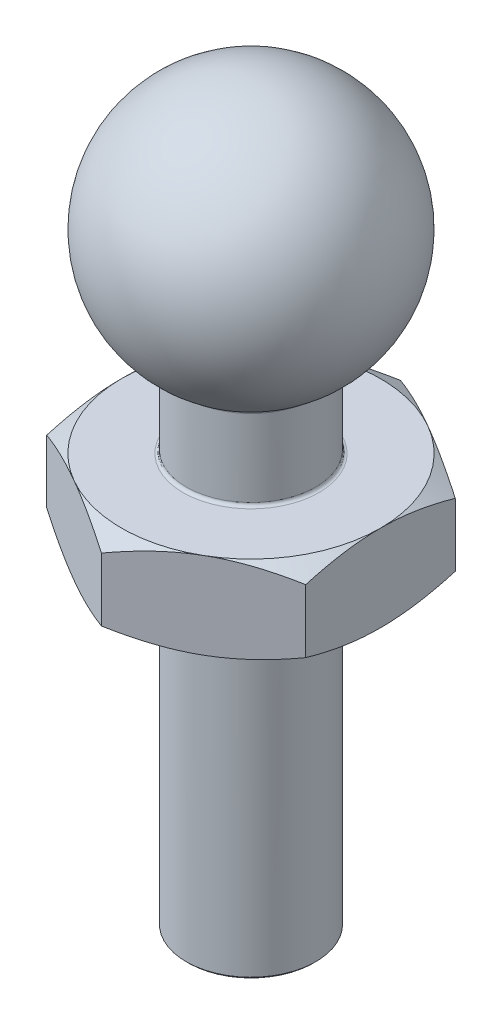
from build123d import *

# Parameters (mm, degrees)
CHAMFER1_SIZE       = 0.05
BOSS_EXTRUDE1_START = 2
SKETCH6_R           = 1.5
BOSS_EXTRUDE1_DEPTH = 2
SKETCH7_OUTSIDE_W   = 18.79
SKETCH7_OUTSIDE_H   = 19.718
SKETCH7_OUTSIDE_R   = 3
CUT_EXTRUDE1_DEPTH  = 2
CUT_EXTRUDE1_DRAFT  = -60
SKETCH8_OUTSIDE_W   = 18.79
SKETCH8_OUTSIDE_H   = 19.718
SKETCH8_OUTSIDE_R   = 3
CUT_EXTRUDE3_DEPTH  = 2
CUT_EXTRUDE3_DRAFT  = -60
FILLET1_R           = 0.075


with BuildPart() as part:
    # Sketch1 → Revolve1 (revolve)
    with BuildSketch(Plane.XY):
        with BuildLine():
            Line((0, 0), (1.5, 0))
            Line((1.5, 0), (1.5, 11.401923789))
            ThreePointArc((1.5, 11.401923789), (2.897777479, 14.776457135), (0, 17))
            Line((0, 17), (0, 11))
            Line((0, 11), (0, 0))
        make_face()
    revolve(axis=Axis((0, 11, 0), (0, -1, 0)))

    # Chamfer1
    chamfer1_edges = [part.edges().sort_by_distance(p)[0] for p in [
        (-1.5, 0, 0),
    ]]
    chamfer(chamfer1_edges, length=CHAMFER1_SIZE)

    # Sketch6 → Boss-Extrude1 (add)
    with BuildSketch(Plane(origin=(0, 7.5, 0), x_dir=(1, 0, 0), z_dir=(0, 1, 0)).offset(BOSS_EXTRUDE1_START)):
        Polygon((3, 1.732050808), (0, 3.464101615), (-3, 1.732050808), (-3, -1.732050808), (0, -3.464101615), (3, -1.732050808), align=None)
        with Locations(Location((0, 0, 0), (0, 0, 180))):
            Circle(SKETCH6_R, mode=Mode.SUBTRACT)
    extrude(amount=-BOSS_EXTRUDE1_DEPTH)


with BuildPart() as cut_extrude1_tool:
    # Sketch7 outside → Cut-Extrude1 (with draft: the straight prism first)
    with BuildSketch(Plane.XZ.offset(-7.5)):
        Rectangle(SKETCH7_OUTSIDE_W, SKETCH7_OUTSIDE_H)
        Circle(SKETCH7_OUTSIDE_R, mode=Mode.SUBTRACT)
    extrude(amount=-CUT_EXTRUDE1_DEPTH)
    # Cut-Extrude1: the draft: its side faces are tilted about the plane it starts from
    cut_extrude1_sides = [cut_extrude1_tool.faces().sort_by_distance(p)[0] for p in [
        (0, 8.5, -9.859),
        (9.395, 8.5, 0),
        (0, 8.5, 9.859),
        (-9.395, 8.5, 0),
        (-3, 8.5, 0),
    ]]
    draft(cut_extrude1_sides, Plane.XZ.offset(-7.5), CUT_EXTRUDE1_DRAFT)


with BuildPart() as part_1:
    add(part.part)

    # Cut-Extrude1: cut by cut_extrude1_tool
    add(cut_extrude1_tool.part, mode=Mode.SUBTRACT)


with BuildPart() as cut_extrude3_tool:
    # Sketch8 outside → Cut-Extrude3 (with draft: the straight prism first)
    with BuildSketch(Plane(origin=(0, 9.5, 0), x_dir=(1, 0, 0), z_dir=(0, 1, 0))):
        Rectangle(SKETCH8_OUTSIDE_W, SKETCH8_OUTSIDE_H)
        Circle(SKETCH8_OUTSIDE_R, mode=Mode.SUBTRACT)
    extrude(amount=-CUT_EXTRUDE3_DEPTH)
    # Cut-Extrude3: the draft: its side faces are tilted about the plane it starts from
    cut_extrude3_sides = [cut_extrude3_tool.faces().sort_by_distance(p)[0] for p in [
        (0, 8.5, 9.859),
        (9.395, 8.5, 0),
        (0, 8.5, -9.859),
        (-9.395, 8.5, 0),
        (-3, 8.5, 0),
    ]]
    draft(cut_extrude3_sides, Plane(origin=(0, 9.5, 0), x_dir=(1, 0, 0), z_dir=(0, 1, 0)), CUT_EXTRUDE3_DRAFT)


with BuildPart() as part_2:
    add(part_1.part)

    # Cut-Extrude3: cut by cut_extrude3_tool
    add(cut_extrude3_tool.part, mode=Mode.SUBTRACT)

    # Fillet1
    fillet1_edges = [part_2.edges().sort_by_distance(p)[0] for p in [
        (-1.5, 9.5, 0),
        (-1.5, 11.401923789, 0),
    ]]
    fillet(fillet1_edges, radius=FILLET1_R)


solid = part_2.part
